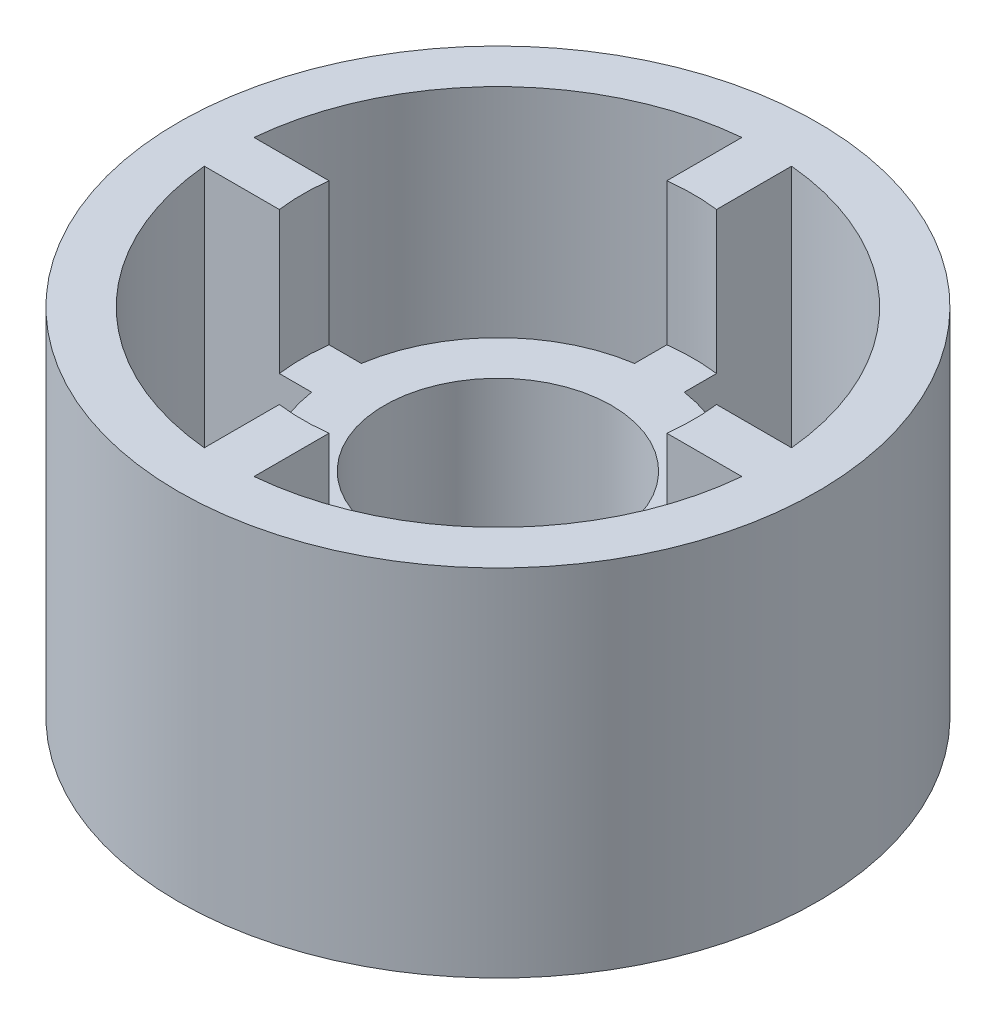
from build123d import *

# Parameters (mm, degrees)
SKETCH_1_R          = 4.5
SKETCH_1_R_2        = 1.6
EXTRUDE_1_DEPTH     = 5
SKETCH_2_R          = 2.75
CUT_EXTRUDE_1_DEPTH = 2


with BuildPart() as part:
    # 草图1 → 凸台-拉伸1 (new body)
    with BuildSketch(Plane(origin=(0, 0, 0), x_dir=(1, 0, 0), z_dir=(0, 1, 0))):
        with Locations(Location((0, 0, 0), (0, 0, 270))):
            Circle(SKETCH_1_R)
        with Locations(Location((0, 0, 0), (0, 0, 270))):
            Circle(SKETCH_1_R_2, mode=Mode.SUBTRACT)
        with BuildLine():
            Line((2.273213584, 0.35), (3.783847249, 0.35))
            ThreePointArc((3.783847249, 0.35), (2.687005769, 2.687005769), (0.35, 3.783847249))
            Line((0.35, 3.783847249), (0.35, 2.273213584))
            ThreePointArc((0.35, 2.273213584), (1.626345597, 1.626345597), (2.273213584, 0.35))
        make_face(mode=Mode.SUBTRACT)
        with BuildLine():
            Line((2.273213584, -0.35), (3.783847249, -0.35))
            ThreePointArc((3.783847249, -0.35), (2.687005769, -2.687005769), (0.35, -3.783847249))
            Line((0.35, -3.783847249), (0.35, -2.273213584))
            ThreePointArc((0.35, -2.273213584), (1.626345597, -1.626345597), (2.273213584, -0.35))
        make_face(mode=Mode.SUBTRACT)
        with BuildLine():
            Line((-0.35, -2.273213584), (-0.35, -3.783847249))
            ThreePointArc((-0.35, -3.783847249), (-2.687005769, -2.687005769), (-3.783847249, -0.35))
            Line((-3.783847249, -0.35), (-2.273213584, -0.35))
            ThreePointArc((-2.273213584, -0.35), (-1.626345597, -1.626345597), (-0.35, -2.273213584))
        make_face(mode=Mode.SUBTRACT)
        with BuildLine():
            Line((-2.273213584, 0.35), (-3.783847249, 0.35))
            ThreePointArc((-3.783847249, 0.35), (-2.687005769, 2.687005769), (-0.35, 3.783847249))
            Line((-0.35, 3.783847249), (-0.35, 2.273213584))
            ThreePointArc((-0.35, 2.273213584), (-1.626345597, 1.626345597), (-2.273213584, 0.35))
        make_face(mode=Mode.SUBTRACT)
    extrude(amount=EXTRUDE_1_DEPTH)

    # 草图2 → 切除-拉伸1 (cut)
    with BuildSketch(Plane(origin=(0, 5, 0), x_dir=(1, 0, 0), z_dir=(0, 1, 0))):
        Circle(SKETCH_2_R)
    extrude(amount=-CUT_EXTRUDE_1_DEPTH, mode=Mode.SUBTRACT)


solid = part.part
